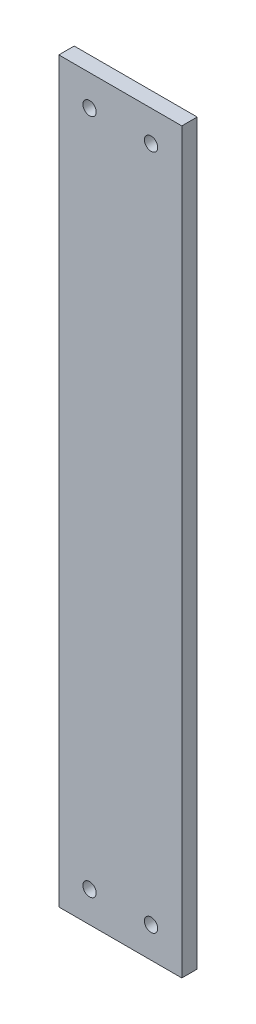
from build123d import *

# Parameters (mm, degrees)
ESQUISSE1_W             = 50.8
ESQUISSE1_H             = 304.8
BOSS_EXTRU_1_DEPTH      = 6.35
ESQUISSE2_R             = 2.75
ENL_V_MAT_EXTRU_1_DEPTH = 155.632604906


with BuildPart() as part:
    # Esquisse1 → Boss.-Extru.1 (new body)
    with BuildSketch(Plane.XY):
        Rectangle(ESQUISSE1_W, ESQUISSE1_H)
    extrude(amount=BOSS_EXTRU_1_DEPTH)

    # Esquisse2 → Enlèv. mat.-Extru.1 (cut, through all)
    with BuildSketch(Plane.XY.offset(6.35)):
        with Locations((12.7, 139.7)):
            Circle(ESQUISSE2_R)
        with Locations((-12.7, 139.7)):
            Circle(ESQUISSE2_R)
        with Locations(Location((12.7, -139.7, 0), (0, 0, 180))):
            Circle(ESQUISSE2_R)
        with Locations(Location((-12.7, -139.7, 0), (0, 0, 180))):
            Circle(ESQUISSE2_R)
    extrude(amount=-ENL_V_MAT_EXTRU_1_DEPTH, mode=Mode.SUBTRACT)


solid = part.part
